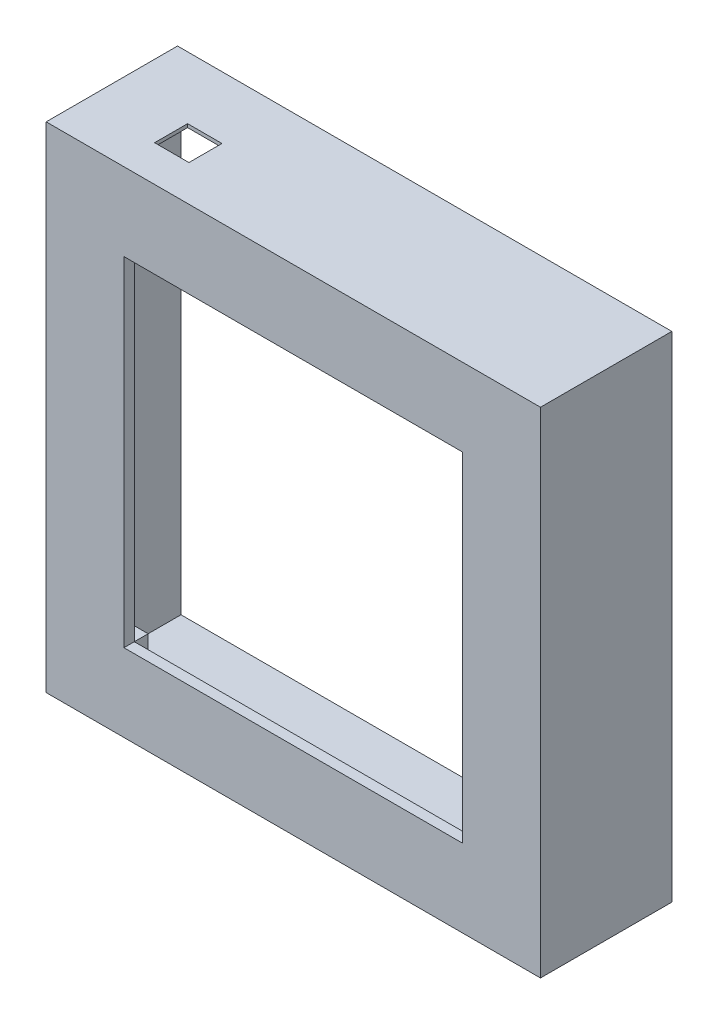
from build123d import *

# Parameters (mm, degrees)
SKETCH1_W           = 143
SKETCH1_H           = 143
SKETCH1_W_2         = 98
SKETCH1_H_2         = 98
BOSS_EXTRUDE1_DEPTH = 3
SKETCH2_W           = 143
SKETCH2_H           = 143
SKETCH2_W_2         = 141
SKETCH2_H_2         = 141
BOSS_EXTRUDE2_DEPTH = 35
SKETCH3_W           = 21.5
SKETCH3_H           = 21.5
BOSS_EXTRUDE3_DEPTH = 4
SKETCH4_W           = 9.937019223
SKETCH4_H           = 9.54986263
CUT_EXTRUDE1_DEPTH  = 4


with BuildPart() as part:
    # Sketch1 → Boss-Extrude1 (new body)
    with BuildSketch(Plane.XY):
        Rectangle(SKETCH1_W, SKETCH1_H)
        Rectangle(SKETCH1_W_2, SKETCH1_H_2, mode=Mode.SUBTRACT)
    extrude(amount=BOSS_EXTRUDE1_DEPTH)

    # Sketch2 → Boss-Extrude2 (add)
    with BuildSketch(Plane(origin=(0, 0, 0), x_dir=(-1, 0, 0), z_dir=(0, 0, -1))):
        Rectangle(SKETCH2_W, SKETCH2_H)
        Rectangle(SKETCH2_W_2, SKETCH2_H_2, mode=Mode.SUBTRACT)
    extrude(amount=BOSS_EXTRUDE2_DEPTH)

    # Sketch3 → Boss-Extrude3 (add)
    with BuildSketch(Plane(origin=(0, 0, 0), x_dir=(-1, 0, 0), z_dir=(0, 0, -1))):
        with Locations((-59.75, 59.75)):
            Rectangle(SKETCH3_W, SKETCH3_H)
        with Locations((-59.75, -59.75)):
            Rectangle(SKETCH3_W, SKETCH3_H)
        with Locations((59.75, -59.75)):
            Rectangle(SKETCH3_W, SKETCH3_H)
        with Locations((59.75, 59.75)):
            Rectangle(SKETCH3_W, SKETCH3_H)
    extrude(amount=BOSS_EXTRUDE3_DEPTH)

    # Sketch4 → Cut-Extrude1 (cut)
    with BuildSketch(Plane(origin=(0, 71.5, 0), x_dir=(1, 0, 0), z_dir=(0, 1, 0))):
        with Locations((-45.619951888, 12.228924985)):
            Rectangle(SKETCH4_W, SKETCH4_H)
    extrude(amount=-CUT_EXTRUDE1_DEPTH, mode=Mode.SUBTRACT)


solid = part.part
